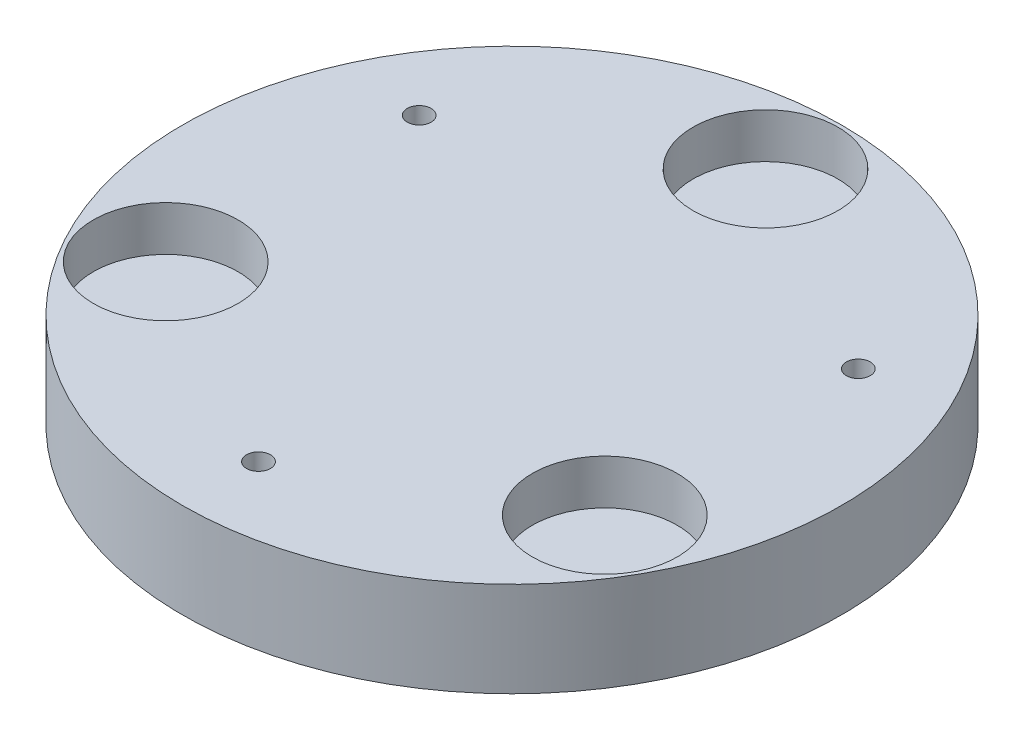
from build123d import *

# Parameters (mm, degrees)
ESQUISSE11_R                 = 10
ENL_V_MAT_EXTRU_4_DEPTH      = 6.2
ESQUISSE12_R                 = 1.65
ENL_V_MAT_EXTRU_5_DEPTH      = 66.664775353
ESQUISSE14_R                 = 2.85
ENL_V_MAT_EXTRU_8_DEPTH      = 3.6
R_P_TITION_CIRCULAIRE7_COUNT = 3


with BuildPart() as part:
    # Esquisse1 → Révolution1 (revolve)
    with BuildSketch(Plane.XY, mode=Mode.PRIVATE) as r_volution1_sk:
        with BuildLine():
            Line((-45.5, 158.120727786), (-45.5, 145.030169275))
            ThreePointArc((-45.5, 145.030169275), (-23.015367368, 150.247438797), (0, 152))
            Line((0, 152), (0, 158.120727786))
            Line((0, 158.120727786), (-45.5, 158.120727786))
        make_face()
    revolve(r_volution1_sk.sketch.rotate(Axis((0, 0, 0), (0, 1, 0)), 270), axis=Axis((0, 0, 0), (0, 1, 0)))

    # Esquisse11 → Enlèv. mat.-Extru.4 (cut)
    with BuildSketch(Plane(origin=(0, 158.120727786, 0), x_dir=(1, 0, 0), z_dir=(0, 1, 0))):
        with Locations(Location((0, 35, 0), (0, 0, 270))):
            Circle(ESQUISSE11_R)
    enl_v_mat_extru_4 = extrude(amount=-ENL_V_MAT_EXTRU_4_DEPTH, mode=Mode.SUBTRACT)

    # Esquisse12 → Enlèv. mat.-Extru.5 (cut, through all)
    with BuildSketch(Plane(origin=(0, 158.120727786, 0), x_dir=(1, 0, 0), z_dir=(0, 1, 0))):
        with Locations(Location((-30.310889132, 17.5, 0), (0, 0, 270))):
            Circle(ESQUISSE12_R)
    enl_v_mat_extru_5 = extrude(amount=-ENL_V_MAT_EXTRU_5_DEPTH, mode=Mode.SUBTRACT)

    # Esquisse14 → Enlèv. mat.-Extru.8 (cut)
    with BuildSketch(Plane(origin=(0, 147.120727786, 0), x_dir=(1, 0, 0), z_dir=(0, 1, 0))):
        with Locations(Location((-30.310889132, 17.5, 0), (0, 0, 134.033255464))):
            Circle(ESQUISSE14_R)
    enl_v_mat_extru_8 = extrude(amount=ENL_V_MAT_EXTRU_8_DEPTH, mode=Mode.SUBTRACT)

    # Répétition circulaire7: Enlèv. mat.-Extru.4, Enlèv. mat.-Extru.5, Enlèv. mat.-Extru.8 ×3 about axis
    r_p_tition_circulaire7_axis = Axis((0, 0, 0), (0, 1, 0))
    add([enl_v_mat_extru_4.rotate(r_p_tition_circulaire7_axis, i * 360 / R_P_TITION_CIRCULAIRE7_COUNT) for i in range(1, R_P_TITION_CIRCULAIRE7_COUNT)], mode=Mode.SUBTRACT)
    add([enl_v_mat_extru_5.rotate(r_p_tition_circulaire7_axis, i * 360 / R_P_TITION_CIRCULAIRE7_COUNT) for i in range(1, R_P_TITION_CIRCULAIRE7_COUNT)], mode=Mode.SUBTRACT)
    add([enl_v_mat_extru_8.rotate(r_p_tition_circulaire7_axis, i * 360 / R_P_TITION_CIRCULAIRE7_COUNT) for i in range(1, R_P_TITION_CIRCULAIRE7_COUNT)], mode=Mode.SUBTRACT)


solid = part.part
